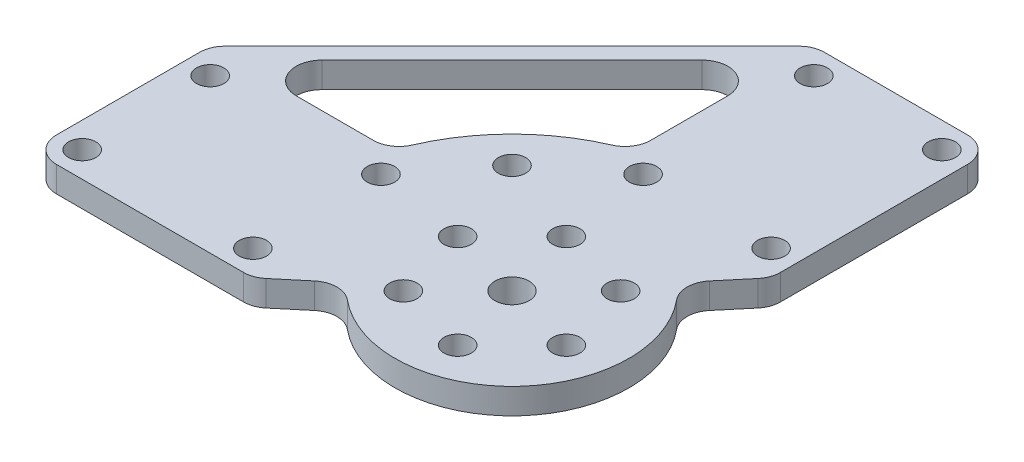
from build123d import *

# Parameters (mm, degrees)
BOSS_EXTRUDE1_DEPTH      = 3
M3_CLEARANCE_HOLE1_D     = 3.2
M3_CLEARANCE_HOLE2_D     = 3.2
F_4_0_4_DIAMETER_HOLE1_D = 4
CUT_EXTRUDE3_DEPTH       = 3
FILLET5_R                = 3
M3_CLEARANCE_HOLE3_D     = 3.2
CUT_EXTRUDE4_START       = -3
CUT_EXTRUDE4_DEPTH       = 3
FILLET6_R                = 3


with BuildPart() as part:
    # Sketch2 → Boss-Extrude1 (new body)
    with BuildSketch(Plane(origin=(0, 0, 0), x_dir=(1, 0, 0), z_dir=(0, 1, 0))):
        with BuildLine():
            Line((-16.5, -13.85), (-42.5, -13.85))
            Line((-42.5, -13.85), (-42.5, 7.15))
            Line((-42.5, 7.15), (-24.825, 24.825))
            Line((-24.825, 24.825), (25.724873734, -25.724873734))
            Line((25.724873734, -25.724873734), (16.974873734, -34.474873734))
            ThreePointArc((16.974873734, -34.474873734), (14.482141695, -35.49995444), (12, -34.449489743))
            Line((12, -34.449489743), (12, -39))
            Line((12, -39), (-12, -39))
            Line((-12, -39), (-12, -34.449489743))
            ThreePointArc((-12, -34.449489743), (-17.17260394, -34.259908888), (-16.5, -29.127718677))
            Line((-16.5, -29.127718677), (-16.5, -13.85))
        make_face()
    extrude(amount=BOSS_EXTRUDE1_DEPTH)

    # Mirror5: part across plane


with BuildPart() as part_1:
    add(part.part)
    add(part.part.mirror(Plane(origin=(25.724873734, 3, 25.724873734), x_dir=(0.7071067811865465, 0, 0.7071067811865487), z_dir=(-0.7071067811865486, 0, 0.7071067811865465))))

    # M3 Clearance Hole1 (through all)
    with Locations(Plane(origin=(0, 3, 0), x_dir=(1, 0, 0), z_dir=(0, 1, 0))):
        with Locations((-39.5, 4.15), (-19.5, 4.15), (-19.5, -10.85), (-39.5, -10.85), (-4.15, 19.5), (-4.15, 39.5), (10.85, 39.5), (10.85, 19.5)):
            Hole(M3_CLEARANCE_HOLE1_D / 2)

    # M3 Clearance Hole2 (through all)
    with Locations(Plane(origin=(0, 3, 0), x_dir=(1, 0, 0), z_dir=(0, 1, 0))):
        with Locations((-2.329371406, 8.693332437), (6.363961031, 6.363961031), (8.693332437, -2.329371406), (2.329371406, -8.693332437), (-6.363961031, -6.363961031), (-8.693332437, 2.329371406)):
            Hole(M3_CLEARANCE_HOLE2_D / 2)

    # Ø4.0 (4) Diameter Hole1 (through all)
    with Locations(Plane(origin=(0, 3, 0), x_dir=(1, 0, 0), z_dir=(0, 1, 0))):
        with Locations((0, 0)):
            Hole(F_4_0_4_DIAMETER_HOLE1_D / 2)

    # Sketch13 → Cut-Extrude3 (cut)
    with BuildSketch(Plane(origin=(0, 3, 0), x_dir=(1, 0, 0), z_dir=(0, 1, 0))):
        with BuildLine():
            Line((-39.671572875, 7.15), (-21.333717444, 7.15))
            ThreePointArc((-21.333717444, 7.15), (-19.129970762, 11.844586048), (-15.909902577, 15.909902577))
            Line((-15.909902577, 15.909902577), (-23.410786438, 23.410786438))
            Line((-23.410786438, 23.410786438), (-39.671572875, 7.15))
        make_face()
    cut_extrude3 = extrude(amount=-CUT_EXTRUDE3_DEPTH, mode=Mode.SUBTRACT)

    # Mirror6: Cut-Extrude3 across plane
    add(cut_extrude3.mirror(Plane(origin=(0, -28.792883686, 0), x_dir=(0.7071067811865467, 0, 0.7071067811865482), z_dir=(-0.7071067811865482, 0, 0.7071067811865468))), mode=Mode.SUBTRACT)

    # Fillet5
    fillet5_edges = [part_1.edges().sort_by_distance(p)[0] for p in [
        (-21.333717444, 1.5, -7.15),
        (-39.671572875, 1.5, -7.15),
        (-7.15, 1.5, -21.333717444),
        (-7.15, 1.5, -39.671572875),
    ]]
    fillet(fillet5_edges, radius=FILLET5_R)

    # M3 Clearance Hole3 (through all)
    with Locations(Plane(origin=(0, 3, 0), x_dir=(1, 0, 0), z_dir=(0, 1, 0))):
        with Locations((-12.727922061, 12.727922061)):
            Hole(M3_CLEARANCE_HOLE3_D / 2)

    # Sketch16 → Cut-Extrude4 (cut)
    with BuildSketch(Plane(origin=(0, 3, 0), x_dir=(1, 0, 0), z_dir=(0, 1, 0)).offset(CUT_EXTRUDE4_START)):
        with BuildLine():
            Line((-16.5, -13.85), (-10.493288043, -8.808002387))
            ThreePointArc((-10.493288043, -8.808002387), (9.687362902, -9.687362902), (8.808002387, 10.493288043))
            Line((8.808002387, 10.493288043), (13.85, 16.5))
            Line((13.85, 16.5), (29.127718677, 16.5))
            ThreePointArc((29.127718677, 16.5), (34.259908888, 17.17260394), (34.449489743, 12))
            Line((34.449489743, 12), (39, 12))
            Line((39, 12), (39, -12))
            Line((39, -12), (34.449489743, -12))
            ThreePointArc((34.449489743, -12), (35.49995444, -14.482141695), (34.474873734, -16.974873734))
            Line((34.474873734, -16.974873734), (16.974873734, -34.474873734))
            ThreePointArc((16.974873734, -34.474873734), (14.482141695, -35.49995444), (12, -34.449489743))
            Line((12, -34.449489743), (12, -39))
            Line((12, -39), (-12, -39))
            Line((-12, -39), (-12, -34.449489743))
            ThreePointArc((-12, -34.449489743), (-17.17260394, -34.259908888), (-16.5, -29.127718677))
            Line((-16.5, -29.127718677), (-16.5, -13.85))
        make_face()
    extrude(amount=CUT_EXTRUDE4_DEPTH, mode=Mode.SUBTRACT)

    # Fillet6
    fillet6_edges = [part_1.edges().sort_by_distance(p)[0] for p in [
        (-16.5, 1.5, 13.85),
        (-42.5, 1.5, 13.85),
        (-42.5, 1.5, -7.15),
        (-10.493288043, 1.5, 8.808002387),
        (8.808002387, 1.5, -10.493288043),
        (-7.15, 1.5, -42.5),
        (13.85, 1.5, -42.5),
        (13.85, 1.5, -16.5),
    ]]
    fillet(fillet6_edges, radius=FILLET6_R)


solid = part_1.part
